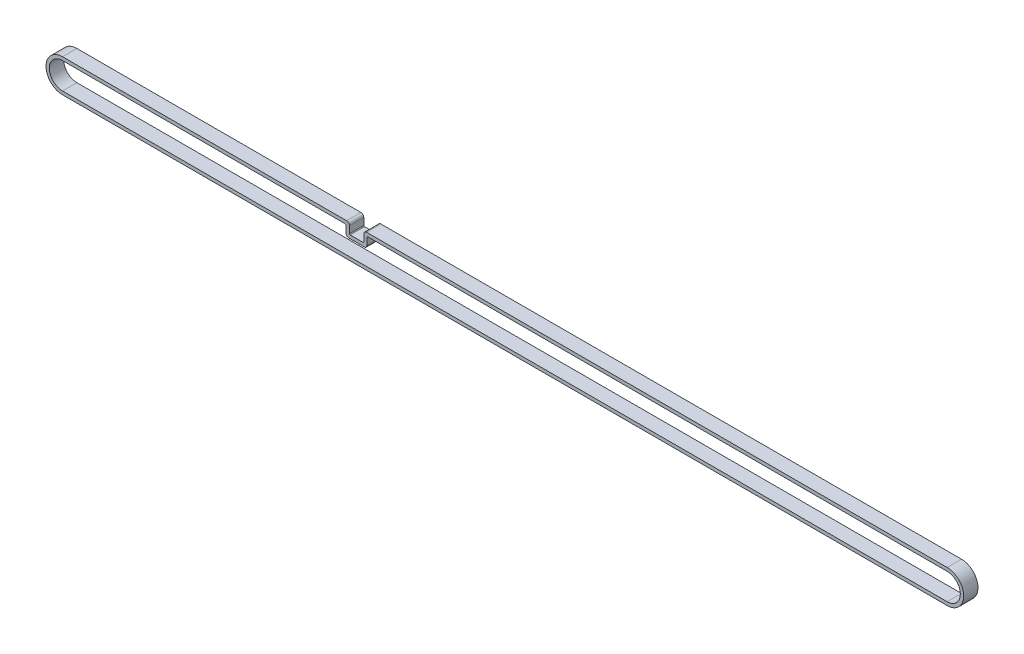
from build123d import *

# Parameters (mm, degrees)
SALIENTE_EXTRUIR1_DEPTH = 6
REDONDEO1_R             = 0.3
REDONDEO2_R             = 1.2


with BuildPart() as part:
    # Croquis1 → Saliente-Extruir1 (new body)
    with BuildSketch(Plane.XY):
        with BuildLine():
            Line((0, 6.9), (120, 6.9))
            Line((120, 6.9), (120, 2.5))
            Line((120, 2.5), (126, 2.5))
            Line((126, 2.5), (126, 6.9))
            Line((126, 6.9), (370, 6.9))
            ThreePointArc((370, 6.9), (376.9, 0), (370, -6.9))
            Line((370, -6.9), (0, -6.9))
            ThreePointArc((0, -6.9), (-6.9, 0), (0, 6.9))
        make_face()
        with BuildLine():
            Line((0, 5.5), (118.6, 5.5))
            Line((118.6, 5.5), (118.6, 1.1))
            Line((118.6, 1.1), (127.4, 1.1))
            Line((127.4, 1.1), (127.4, 5.5))
            Line((127.4, 5.5), (370, 5.5))
            ThreePointArc((370, 5.5), (375.5, 0), (370, -5.5))
            Line((370, -5.5), (0, -5.5))
            ThreePointArc((0, -5.5), (-5.5, 0), (0, 5.5))
        make_face(mode=Mode.SUBTRACT)
    extrude(amount=SALIENTE_EXTRUIR1_DEPTH)

    # Redondeo1
    redondeo1_edges = [part.edges().sort_by_distance(p)[0] for p in [
        (120, 2.5, 3),
        (126, 2.5, 3),
        (127.4, 5.5, 3),
        (118.6, 5.5, 3),
    ]]
    fillet(redondeo1_edges, radius=REDONDEO1_R)

    # Redondeo2
    redondeo2_edges = [part.edges().sort_by_distance(p)[0] for p in [
        (120, 6.9, 3),
        (126, 6.9, 3),
        (127.4, 1.1, 3),
        (118.6, 1.1, 3),
    ]]
    fillet(redondeo2_edges, radius=REDONDEO2_R)


solid = part.part
